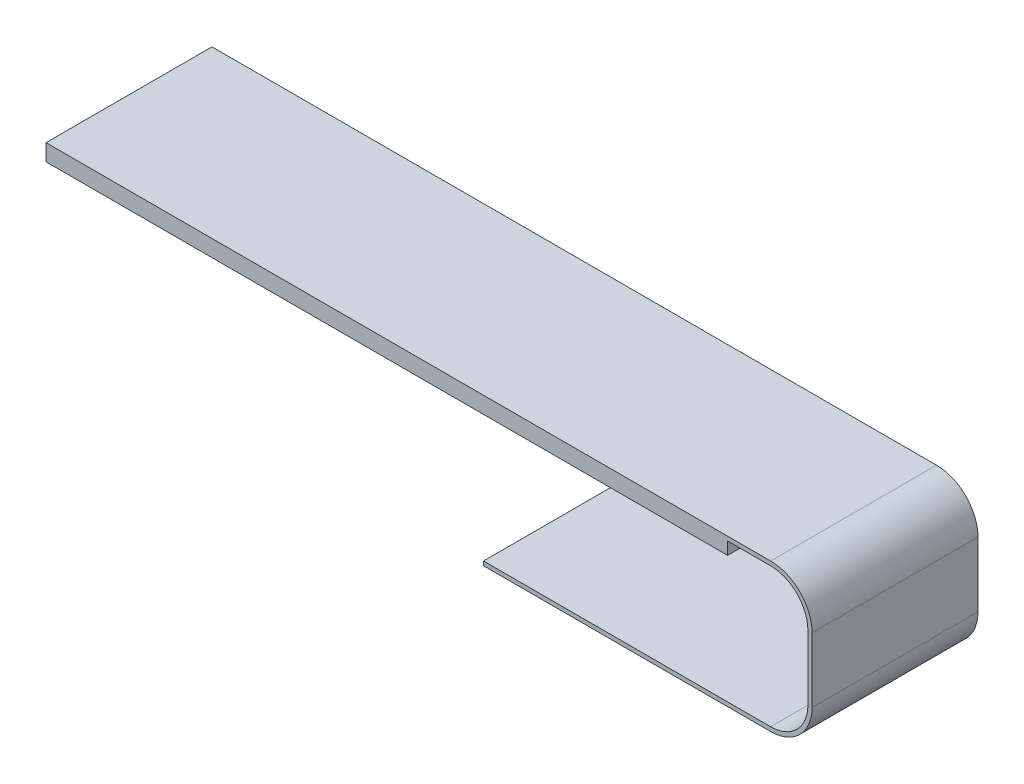
from build123d import *

# Parameters (mm, degrees)
EXTRUDE_1_DEPTH     = 4
SKETCH_2_W          = 16.43
SKETCH_2_H          = 4
EXTRUDE_2_DEPTH     = 0.3
SKETCH_5_W          = 1.626393804
SKETCH_5_H          = 0.567965398
CUT_EXTRUDE_1_DEPTH = 0.02


with BuildPart() as part:
    # 草图1 → 凸台-拉伸1 (new body)
    with BuildSketch(Plane.XY):
        with BuildLine():
            Line((0, 0), (17.465, 0))
            ThreePointArc((17.465, 0), (18.101396103, -0.263603897), (18.365, -0.9))
            Line((18.365, -0.9), (18.365, -2.46))
            ThreePointArc((18.365, -2.46), (18.101396103, -3.096396103), (17.465, -3.36))
            Line((17.465, -3.36), (10.545, -3.36))
            Line((10.545, -3.36), (10.545, -3.46))
            Line((10.545, -3.46), (17.464999994, -3.46))
            ThreePointArc((17.464999994, -3.46), (18.172106779, -3.167106783), (18.465, -2.46))
            Line((18.465, -2.46), (18.465, -0.9))
            ThreePointArc((18.465, -0.9), (18.172106781, -0.192893219), (17.465, 0.1))
            Line((17.465, 0.1), (0, 0.1))
            Line((0, 0.1), (0, 0))
        make_face()
    extrude(amount=EXTRUDE_1_DEPTH)

    # 草图2 → 凸台-拉伸2 (add)
    with BuildSketch(Plane.XZ):
        with Locations((8.215, 2)):
            Rectangle(SKETCH_2_W, SKETCH_2_H)
    extrude(amount=EXTRUDE_2_DEPTH)

    # 草图5 → 切除-拉伸1 (cut)
    with BuildSketch(Plane.XZ.offset(3.46)):
        with Locations((11.358196902, 3.395)):
            Rectangle(SKETCH_5_W, SKETCH_5_H)
        with Locations((11.358196902, 2.465)):
            Rectangle(SKETCH_5_W, SKETCH_5_H)
        with Locations((11.358196902, 1.535)):
            Rectangle(SKETCH_5_W, SKETCH_5_H)
        with Locations((11.358196902, 0.605)):
            Rectangle(SKETCH_5_W, SKETCH_5_H)
    extrude(amount=-CUT_EXTRUDE_1_DEPTH, mode=Mode.SUBTRACT)


solid = part.part
